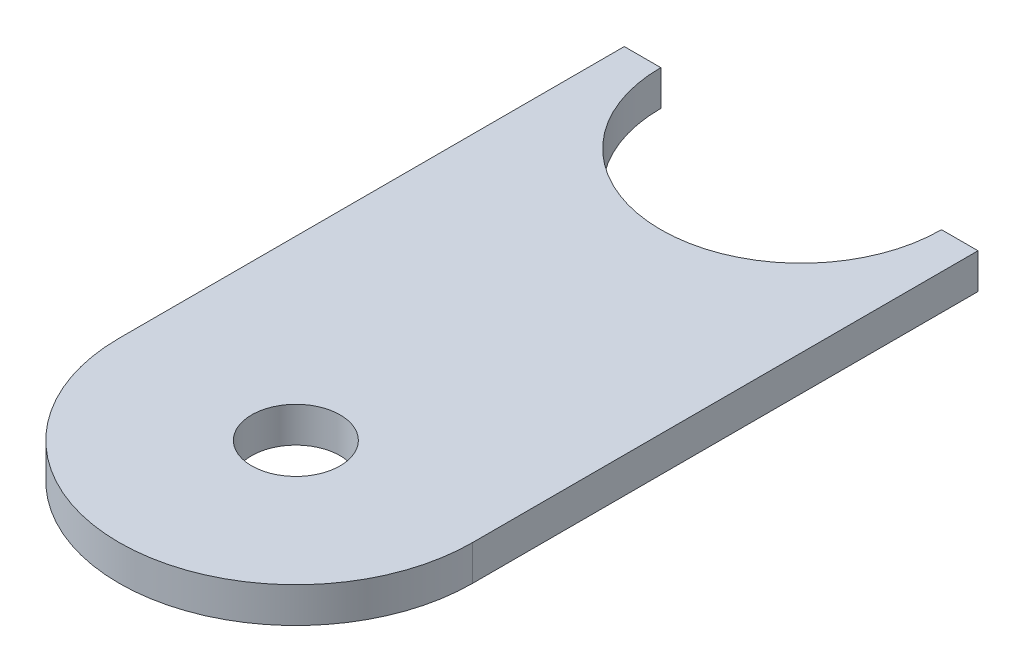
from build123d import *

# Parameters (mm, degrees)
SKETCH1_R           = 5
BOSS_EXTRUDE1_DEPTH = 4


with BuildPart() as part:
    # Sketch1 → Boss-Extrude1 (new body)
    with BuildSketch(Plane(origin=(0, 0, 0), x_dir=(1, 0, 0), z_dir=(0, 1, 0))):
        with BuildLine():
            Line((20, 0), (20, -57.142857143))
            ThreePointArc((20, -57.142857143), (0, -77.142857143), (-20, -57.142857143))
            Line((-20, -57.142857143), (-20, 0))
            Line((-20, 0), (-15.875, 0))
            ThreePointArc((-15.875, 0), (0, -15.875), (15.875, 0))
            Line((15.875, 0), (20, 0))
        make_face()
        with Locations(Location((0, -57.142857143, 0), (0, 0, 270))):
            Circle(SKETCH1_R, mode=Mode.SUBTRACT)
    extrude(amount=BOSS_EXTRUDE1_DEPTH)


solid = part.part
